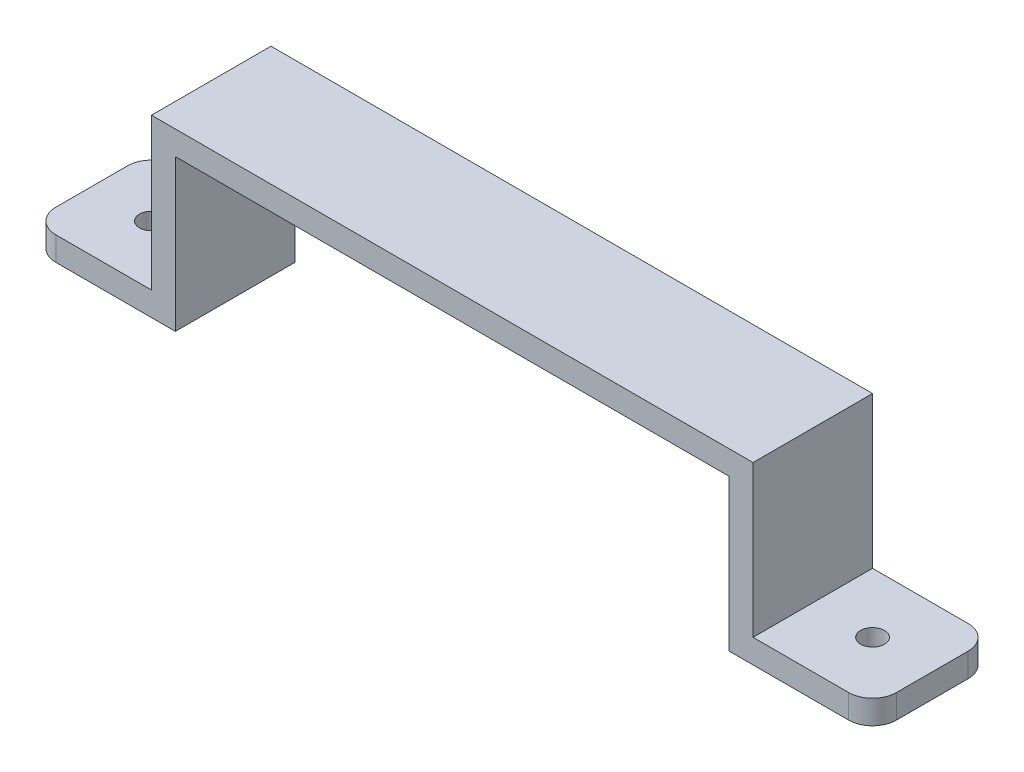
from build123d import *

# Parameters (mm, degrees)
EXTRUDE_1_DEPTH     = 15
SKETCH_2_R          = 1.5
CUT_EXTRUDE_1_DEPTH = 20
FILLET_1_R          = 3


with BuildPart() as part:
    # 草图1 → 凸台-拉伸1 (new body)
    with BuildSketch(Plane.XY):
        Polygon((-37.75, 0), (37.75, 0), (37.75, -19), (52.75, -19), (52.75, -22), (34.75, -22), (34.75, -3), (-34.75, -3), (-34.75, -22), (-52.75, -22), (-52.75, -19), (-37.75, -19), align=None)
    extrude(amount=EXTRUDE_1_DEPTH)

    # 草图2 → 切除-拉伸1 (cut)
    with BuildSketch(Plane(origin=(0, -19, 0), x_dir=(1, 0, 0), z_dir=(0, 1, 0))):
        with Locations(Location((-45.25, -7.5, 0), (0, 0, 270))):
            Circle(SKETCH_2_R)
        with Locations(Location((45.25, -7.5, 0), (0, 0, 270))):
            Circle(SKETCH_2_R)
    extrude(amount=-CUT_EXTRUDE_1_DEPTH, mode=Mode.SUBTRACT)

    # 圆角1
    fillet_1_edges = [part.edges().sort_by_distance(p)[0] for p in [
        (-52.75, -20.5, 15),
        (52.75, -20.5, 0),
        (-52.75, -20.5, 0),
        (52.75, -20.5, 15),
    ]]
    fillet(fillet_1_edges, radius=FILLET_1_R)


solid = part.part
